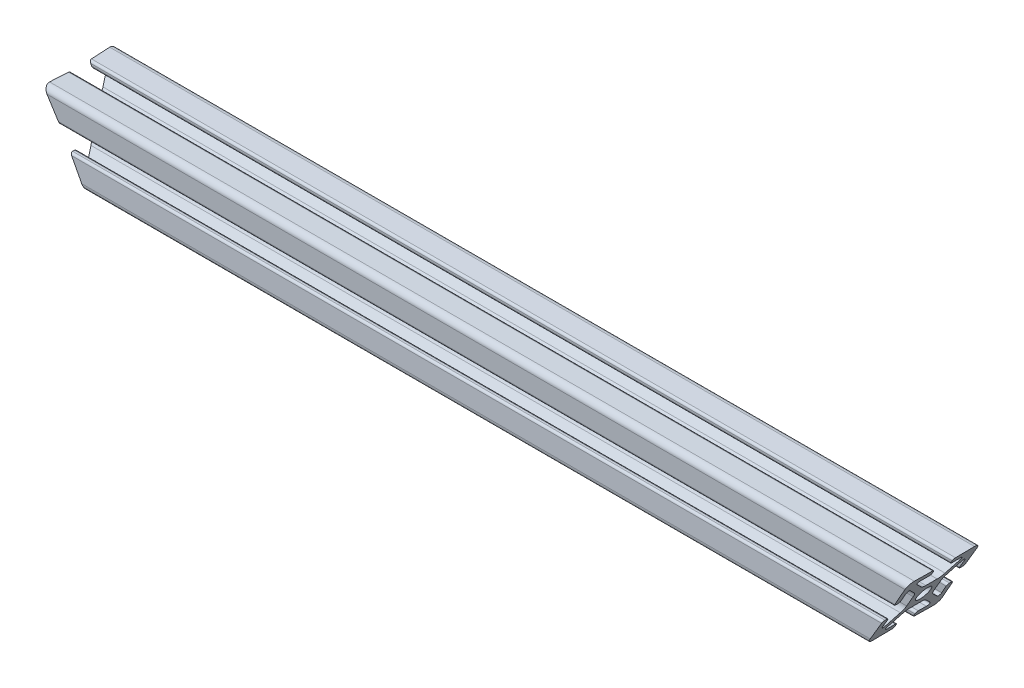
from build123d import *

# Parameters (mm, degrees)
BOSS_EXTRUDE1_DEPTH      = 152.4
BOSS_EXTRUDE1_DEPTH_BACK = 152.4
CUT_EXTRUDE1_DEPTH       = 12.7
CUT_EXTRUDE1_DEPTH_BACK  = 12.7


with BuildPart() as part:
    # Sketch3 → Boss-Extrude1 (new, two sides: drawn at the far end of the back side and taken through both)
    with BuildSketch(Plane(origin=(0, 0, 0), x_dir=(0, 0, -1), z_dir=(1, 0, 0)).offset(-BOSS_EXTRUDE1_DEPTH_BACK)):
        with BuildLine():
            Line((0, 4.826), (1.984228399, 4.826))
            ThreePointArc((1.984228399, 4.826), (3.199248297, 5.067682484), (4.229292429, 5.75593597))
            Line((4.229292429, 5.75593597), (7.586577723, 9.113221264))
            ThreePointArc((7.586577723, 9.113221264), (7.746562132, 9.955883421), (7.021168939, 10.413572441))
            Line((7.021168939, 10.413572441), (4.090593416, 10.311234489))
            ThreePointArc((4.090593416, 10.311234489), (3.534670322, 10.524633371), (3.302, 11.072770299))
            Line((3.302, 11.072770299), (3.302, 11.70815736))
            ThreePointArc((3.302, 11.70815736), (3.515863072, 12.237487038), (4.037406584, 12.46969317))
            Line((4.037406584, 12.46969317), (10.597084223, 12.698762161))
            ThreePointArc((10.597084223, 12.698762161), (12.104840979, 12.104840979), (12.698762161, 10.597084223))
            Line((12.698762161, 10.597084223), (12.46969317, 4.037406584))
            ThreePointArc((12.46969317, 4.037406584), (12.237487038, 3.515863072), (11.70815736, 3.302))
            Line((11.70815736, 3.302), (11.072770299, 3.302))
            ThreePointArc((11.072770299, 3.302), (10.524633371, 3.534670322), (10.311234489, 4.090593416))
            Line((10.311234489, 4.090593416), (10.413572441, 7.021168939))
            ThreePointArc((10.413572441, 7.021168939), (9.955883421, 7.746562132), (9.113221264, 7.586577723))
            Line((9.113221264, 7.586577723), (5.75593597, 4.229292429))
            ThreePointArc((5.75593597, 4.229292429), (5.067682484, 3.199248297), (4.826, 1.984228399))
            Line((4.826, 1.984228399), (4.826, 0))
            Line((4.826, 0), (2.54, 0))
            ThreePointArc((2.54, 0), (1.796051224, 1.796051224), (0, 2.54))
            Line((0, 2.54), (0, 4.826))
        make_face()
    extrude(amount=BOSS_EXTRUDE1_DEPTH + BOSS_EXTRUDE1_DEPTH_BACK)

    # Mirror1: part across plane


with BuildPart() as part_1:
    add(part.part)
    add(part.part.mirror(Plane.ZX))

    # Mirror2: part across plane


with BuildPart() as part_2:
    add(part_1.part)
    add(part_1.part.mirror(Plane.XY))

    # Sketch4 → Cut-Extrude1 (cut, two sides: drawn at the far end of the back side and taken through both)
    with BuildSketch(Plane.XY.offset(-CUT_EXTRUDE1_DEPTH_BACK)):
        Polygon((-154.94, -38.1), (154.94, -38.1), (154.94, 12.7), (152.4, 12.7), (137.735303163, -12.7), (-137.735303163, -12.7), (-152.4, 12.7), (-154.94, 12.7), align=None)
    extrude(amount=CUT_EXTRUDE1_DEPTH + CUT_EXTRUDE1_DEPTH_BACK, mode=Mode.SUBTRACT)


solid = part_2.part
